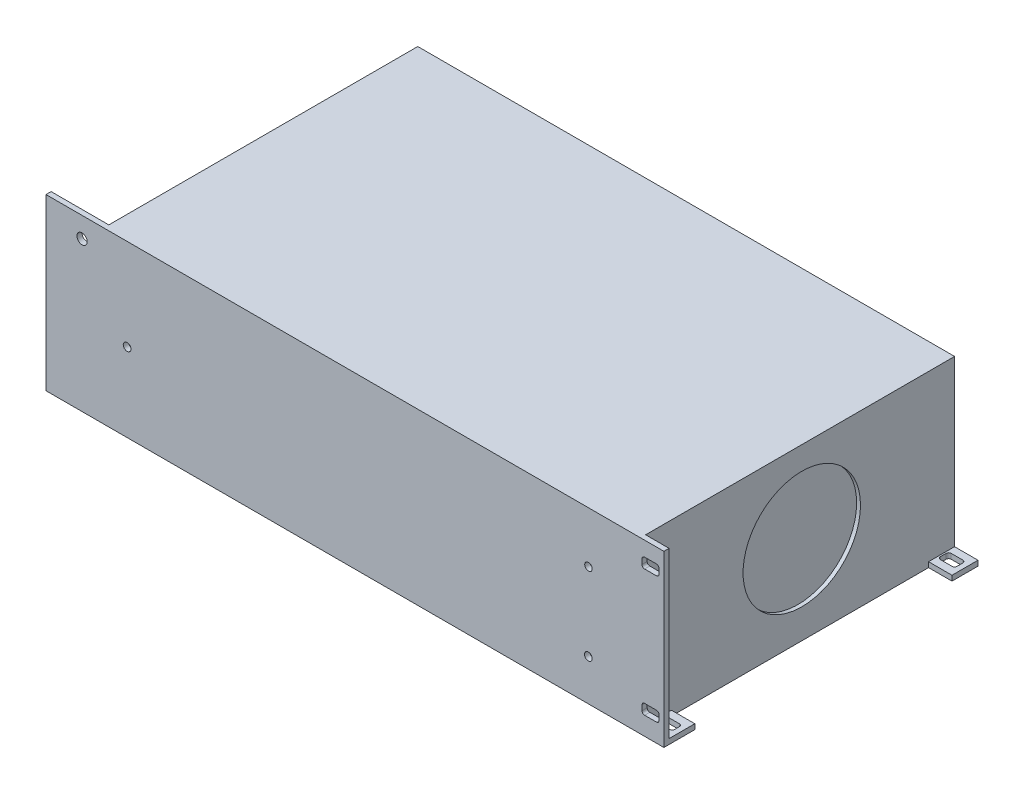
from build123d import *

# Parameters (mm, degrees)
SZKIC1_W                    = 240
SZKIC1_H                    = 122
DODANIE_WYCI_GNI_CIE1_DEPTH = 2
SZKIC2_W                    = 240
SZKIC2_H                    = 2
DODANIE_WYCI_GNI_CIE2_DEPTH = 64
SZKIC3_W                    = 9.1
SZKIC3_H                    = 99.9
SZKIC3_W_2                  = 5.5
WYTNIJ_WYCI_GNI_CIE1_DEPTH  = 180.195703173
SZKIC4_W                    = 208.5
SZKIC4_H                    = 120
DODANIE_WYCI_GNI_CIE3_DEPTH = 64
SZKIC5_R                    = 22.806294832
WYTNIJ_WYCI_GNI_CIE2_DEPTH  = 1.5
SZKIC6_W                    = 16.9
SZKIC6_H                    = 90.349503158
DODANIE_WYCI_GNI_CIE4_DEPTH = 20
WYTNIJ_WYCI_GNI_CIE3_DEPTH  = 180.195703173
SZKIC8_R                    = 2
WYTNIJ_WYCI_GNI_CIE4_DEPTH  = 180.195703173
SZKIC9_R                    = 1.6
SZKIC9_R_2                  = 1.651116854
WYTNIJ_WYCI_GNI_CIE5_DEPTH  = 2
SZKIC10_R                   = 2
WYTNIJ_WYCI_GNI_CIE6_DEPTH  = 2
SZKIC11_R                   = 1.455539738
SZKIC11_R_2                 = 1.5
WYTNIJ_WYCI_GNI_CIE7_DEPTH  = 2


with BuildPart() as part:
    # Szkic1 → Dodanie-wyciągnięcie1 (new body)
    with BuildSketch(Plane(origin=(0, 0, 0), x_dir=(1, 0, 0), z_dir=(0, 1, 0))):
        with Locations((29.433962264, 14.396226415)):
            Rectangle(SZKIC1_W, SZKIC1_H)
    extrude(amount=DODANIE_WYCI_GNI_CIE1_DEPTH)

    # Szkic2 → Dodanie-wyciągnięcie2 (add)
    with BuildSketch(Plane(origin=(0, 2, 0), x_dir=(1, 0, 0), z_dir=(0, 1, 0))):
        with Locations((29.433962264, -45.603773585)):
            Rectangle(SZKIC2_W, SZKIC2_H)
    extrude(amount=DODANIE_WYCI_GNI_CIE2_DEPTH)

    # Szkic3 → Wytnij-wyciągnięcie1 (cut, through all)
    with BuildSketch(Plane(origin=(0, 2, 0), x_dir=(1, 0, 0), z_dir=(0, 1, 0))):
        with Locations((144.883962264, 15.346226415)):
            Rectangle(SZKIC3_W, SZKIC3_H)
        with Locations((-87.816037736, 15.346226415)):
            Rectangle(SZKIC3_W_2, SZKIC3_H)
    extrude(amount=-WYTNIJ_WYCI_GNI_CIE1_DEPTH, mode=Mode.SUBTRACT)

    # Szkic4 → Dodanie-wyciągnięcie3 (add)
    with BuildSketch(Plane(origin=(0, 2, 0), x_dir=(1, 0, 0), z_dir=(0, 1, 0))):
        with Locations((36.083962264, 15.396226415)):
            Rectangle(SZKIC4_W, SZKIC4_H)
    extrude(amount=DODANIE_WYCI_GNI_CIE3_DEPTH)

    # Szkic5 → Wytnij-wyciągnięcie2 (cut)
    with BuildSketch(Plane(origin=(140.333962264, 0, 0), x_dir=(0, 0, -1), z_dir=(1, 0, 0))):
        with Locations((16.047891544, 34.239354483)):
            Circle(SZKIC5_R)
    extrude(amount=-WYTNIJ_WYCI_GNI_CIE2_DEPTH, mode=Mode.SUBTRACT)

    # Szkic6 → Dodanie-wyciągnięcie4 (add)
    with BuildSketch(Plane(origin=(0, 2, 0), x_dir=(1, 0, 0), z_dir=(0, 1, 0))):
        with Locations((-76.616037736, 15.234150699)):
            Rectangle(SZKIC6_W, SZKIC6_H)
    extrude(amount=DODANIE_WYCI_GNI_CIE4_DEPTH)

    # Szkic7 → Wytnij-wyciągnięcie3 (cut, through all)
    with BuildSketch(Plane(origin=(0, 2, 0), x_dir=(1, 0, 0), z_dir=(0, 1, 0))):
        with BuildLine():
            Line((141.913386631, 72.496226415), (146.454537897, 72.496226415))
            ThreePointArc((146.454537897, 72.496226415), (147.147095509, 72.20935966), (147.433962264, 71.516802048))
            Line((147.433962264, 71.516802048), (147.433962264, 69.275650782))
            ThreePointArc((147.433962264, 69.275650782), (147.147095509, 68.583093171), (146.454537897, 68.296226415))
            Line((146.454537897, 68.296226415), (141.913386631, 68.296226415))
            ThreePointArc((141.913386631, 68.296226415), (141.22082902, 68.583093171), (140.933962264, 69.275650782))
            Line((140.933962264, 69.275650782), (140.933962264, 71.516802048))
            ThreePointArc((140.933962264, 71.516802048), (141.22082902, 72.20935966), (141.913386631, 72.496226415))
        make_face()
        with BuildLine():
            Line((141.913386631, -37.603773585), (146.454537897, -37.603773585))
            ThreePointArc((146.454537897, -37.603773585), (147.147095509, -37.89064034), (147.433962264, -38.583197952))
            Line((147.433962264, -38.583197952), (147.433962264, -40.424349218))
            ThreePointArc((147.433962264, -40.424349218), (147.147095509, -41.116906829), (146.454537897, -41.403773585))
            Line((146.454537897, -41.403773585), (141.913386631, -41.403773585))
            ThreePointArc((141.913386631, -41.403773585), (141.22082902, -41.116906829), (140.933962264, -40.424349218))
            Line((140.933962264, -40.424349218), (140.933962264, -38.583197952))
            ThreePointArc((140.933962264, -38.583197952), (141.22082902, -37.89064034), (141.913386631, -37.603773585))
        make_face()
    extrude(amount=-WYTNIJ_WYCI_GNI_CIE3_DEPTH, mode=Mode.SUBTRACT)

    # Szkic8 → Wytnij-wyciągnięcie4 (cut, through all)
    with BuildSketch(Plane(origin=(0, 2, 0), x_dir=(1, 0, 0), z_dir=(0, 1, 0))):
        with Locations(Location((-86.566037736, 70.596226415, 0), (0, 0, 270))):
            Circle(SZKIC8_R)
        with Locations(Location((-86.566037736, -39.353773585, 0), (0, 0, 270))):
            Circle(SZKIC8_R)
    extrude(amount=-WYTNIJ_WYCI_GNI_CIE4_DEPTH, mode=Mode.SUBTRACT)

    # Szkic9 → Wytnij-wyciągnięcie5 (cut)
    with BuildSketch(Plane.XZ):
        with Locations(Location((-76.966037736, 37.203773585, 0), (0, 0, 270))):
            Circle(SZKIC9_R)
        with Locations(Location((108.333962264, 37.203773585, 0), (0, 0, 270))):
            Circle(SZKIC9_R)
        with Locations(Location((108.333962264, -70.996226415, 0), (0, 0, 270))):
            Circle(SZKIC9_R)
        with Locations(Location((-76.914920882, -71.047343269, 0), (0, 0, 270))):
            Circle(SZKIC9_R_2)
    extrude(amount=-WYTNIJ_WYCI_GNI_CIE5_DEPTH, mode=Mode.SUBTRACT)

    # Szkic10 → Wytnij-wyciągnięcie6 (cut)
    with BuildSketch(Plane.XY.offset(46.603773585)):
        with Locations((-76.566037736, 58.1)):
            Circle(SZKIC10_R)
        with BuildLine():
            Line((141.933962264, 60.3), (146.533962264, 60.3))
            ThreePointArc((146.533962264, 60.3), (147.241069045, 60.007106781), (147.533962264, 59.3))
            Line((147.533962264, 59.3), (147.533962264, 57.3))
            ThreePointArc((147.533962264, 57.3), (147.241069045, 56.592893219), (146.533962264, 56.3))
            Line((146.533962264, 56.3), (141.933962264, 56.3))
            ThreePointArc((141.933962264, 56.3), (141.226855483, 56.592893219), (140.933962264, 57.3))
            Line((140.933962264, 57.3), (140.933962264, 59.3))
            ThreePointArc((140.933962264, 59.3), (141.226855483, 60.007106781), (141.933962264, 60.3))
        make_face()
        with BuildLine():
            Line((141.933962264, 11.1), (146.533962264, 11.1))
            ThreePointArc((146.533962264, 11.1), (147.241069045, 10.807106781), (147.533962264, 10.1))
            Line((147.533962264, 10.1), (147.533962264, 8.1))
            ThreePointArc((147.533962264, 8.1), (147.241069045, 7.392893219), (146.533962264, 7.1))
            Line((146.533962264, 7.1), (141.933962264, 7.1))
            ThreePointArc((141.933962264, 7.1), (141.226855483, 7.392893219), (140.933962264, 8.1))
            Line((140.933962264, 8.1), (140.933962264, 10.1))
            ThreePointArc((140.933962264, 10.1), (141.226855483, 10.807106781), (141.933962264, 11.1))
        make_face()
    extrude(amount=-WYTNIJ_WYCI_GNI_CIE6_DEPTH, mode=Mode.SUBTRACT)

    # Szkic11 → Wytnij-wyciągnięcie7 (cut)
    with BuildSketch(Plane.XY.offset(46.603773585)):
        with Locations((120.133962264, 46.144460262)):
            Circle(SZKIC11_R)
        with Locations((120.088143939, 15.95)):
            Circle(SZKIC11_R_2)
        with Locations((-59.066037736, 30.5)):
            Circle(SZKIC11_R_2)
    extrude(amount=-WYTNIJ_WYCI_GNI_CIE7_DEPTH, mode=Mode.SUBTRACT)


solid = part.part
